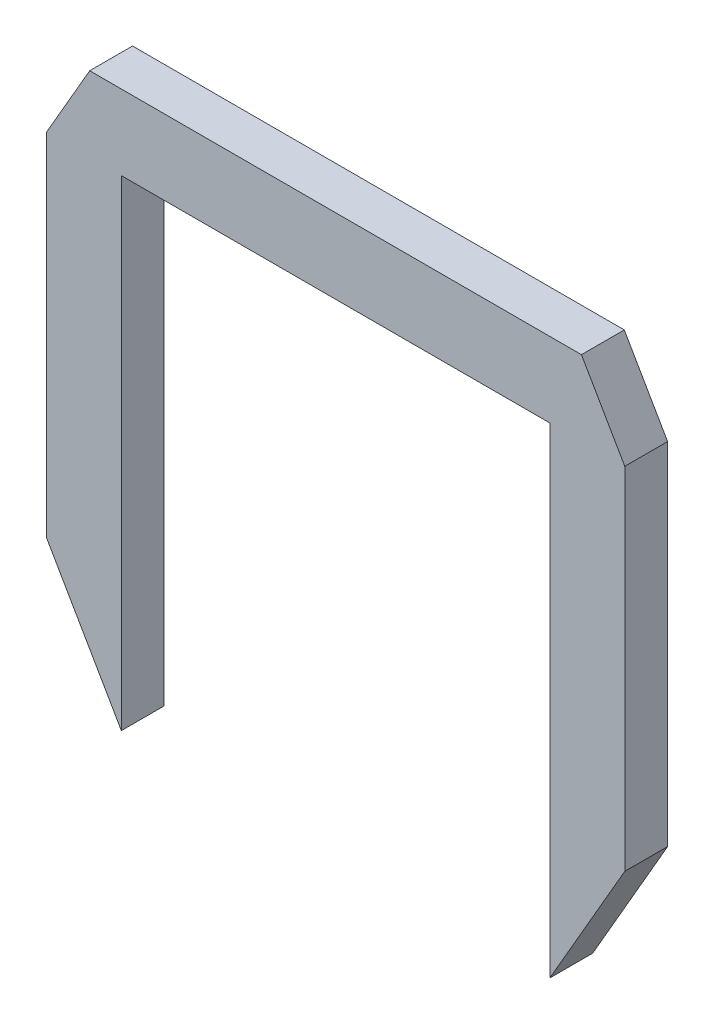
from build123d import *

# Parameters (mm, degrees)
BOSS_EXTRUDE1_DEPTH = 4


with BuildPart() as part:
    # Sketch1 → Boss-Extrude1 (new body)
    with BuildSketch(Plane.XY):
        Polygon((-20, -21.765355562), (-27, -9.640999909), (-27, 23.112863055), (-22.958548116, 30.112863055), (22.955152916, 30.112863055), (27, 23.106982397), (27, -9.640999909), (20, -21.765355562), (20, -16.887136945), (20, 23.112863055), (-20, 23.112863055), (-20, -16.887136945), align=None)
    extrude(amount=BOSS_EXTRUDE1_DEPTH)


solid = part.part
